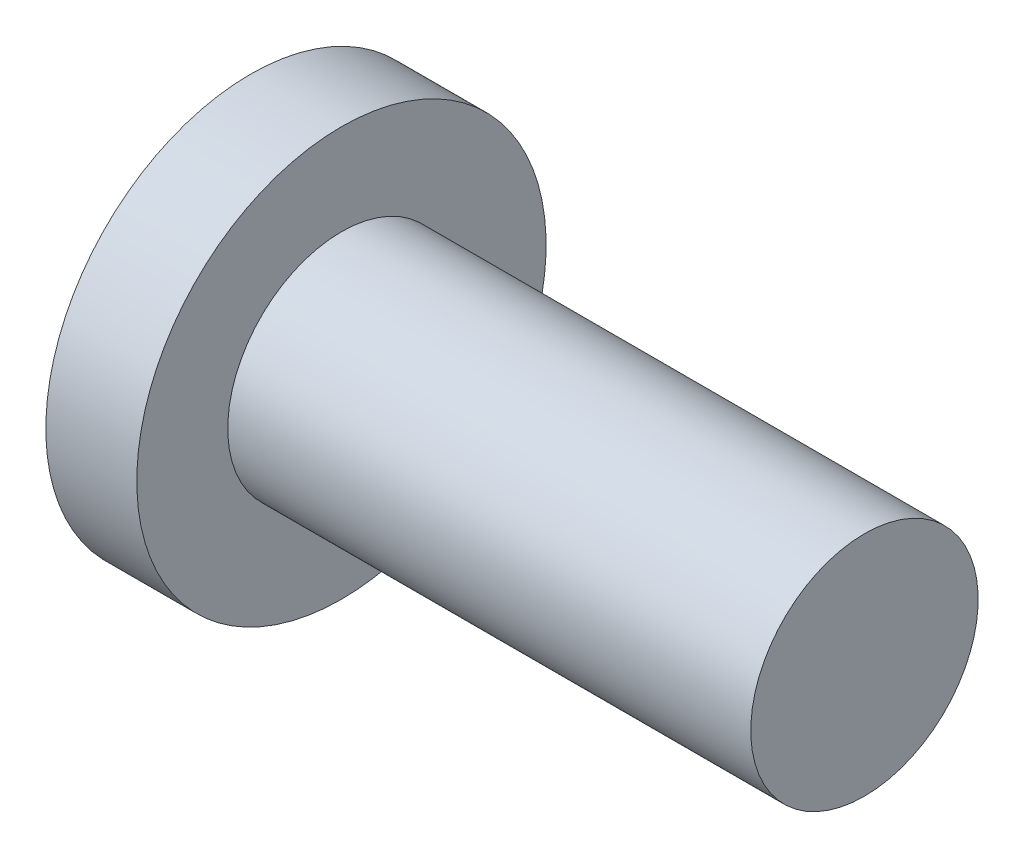
from build123d import *


with BuildPart() as part:
    # Sketch1 → Revolve1 (revolve)
    with BuildSketch(Plane.XY, mode=Mode.PRIVATE) as revolve1_sk:
        Polygon((54, 10), (8, 10), (8, 18), (0, 18), (0, 0), (54, 0), align=None)
    revolve(revolve1_sk.sketch.rotate(Axis((-441.015873016, 0, 0), (1, 0, 0)), 180), axis=Axis((-441.015873016, 0, 0), (1, 0, 0)))


solid = part.part
